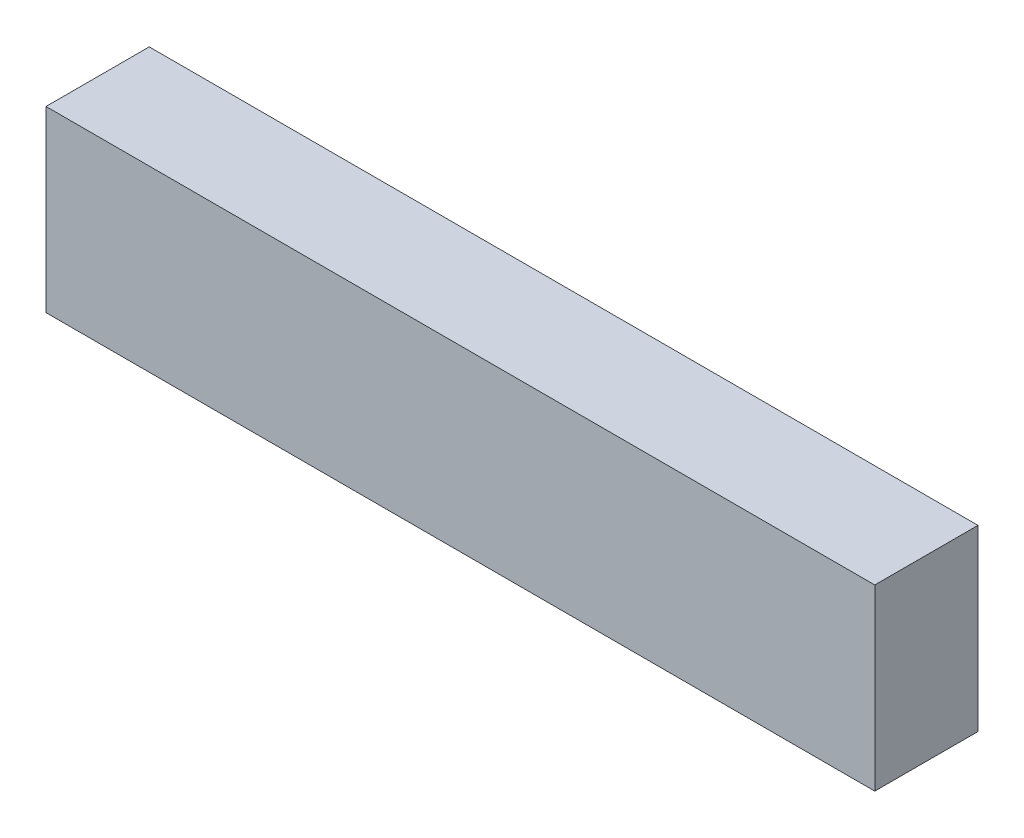
from build123d import *

# Parameters (mm, degrees)
SKETCH1_W                 = 58.2
SKETCH1_H                 = 12.54
BOSS_EXTRUDE1_DEPTH       = 7.25
SHELL1_T                  = -0.5
SHELL1_THICKNESS_2_FACE_W = 57.2
SHELL1_THICKNESS_2_FACE_H = 11.54
SHELL1_THICKNESS_2_DEPTH  = 0.3


with BuildPart() as part:
    # Sketch1 → Boss-Extrude1 (new body)
    with BuildSketch(Plane.XY):
        with Locations((36.9645, -23.9)):
            Rectangle(SKETCH1_W, SKETCH1_H)
    extrude(amount=BOSS_EXTRUDE1_DEPTH)

    # Shell1
    shell1_openings = [part.faces().sort_by_distance(p)[0] for p in [
        (36.9645, -23.9, 0),
    ]]
    offset(amount=SHELL1_T, openings=shell1_openings, kind=Kind.INTERSECTION)

    # Shell1 thickness 2 face (on inner face of the shell) → Shell1 thickness 2 (cut)
    with BuildSketch(Plane(origin=(36.9645, -23.9, 6.75), x_dir=(1, 0, 0), z_dir=(0, 0, 1))):
        Rectangle(SHELL1_THICKNESS_2_FACE_W, SHELL1_THICKNESS_2_FACE_H)
    extrude(amount=SHELL1_THICKNESS_2_DEPTH, mode=Mode.SUBTRACT)


solid = part.part
